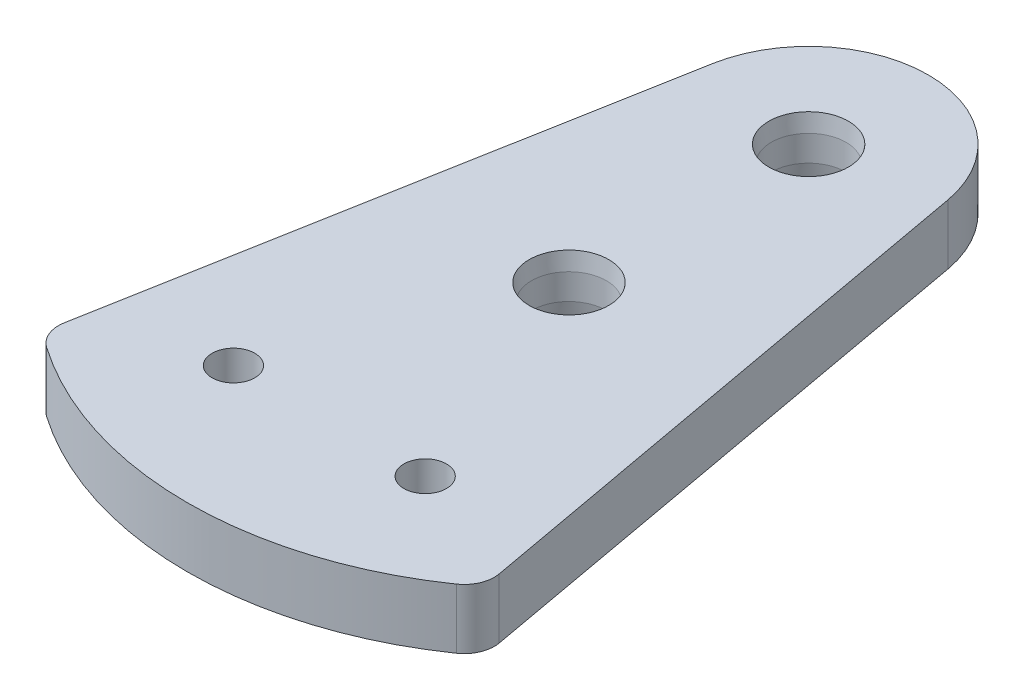
from build123d import *
from OCP.BRepFilletAPI import BRepFilletAPI_MakeChamfer

# Parameters (mm, degrees)
BOSS_EXTRUDE1_DEPTH   = 3.175
F_4_40_TAPPED_HOLE1_D = 2.2606
CUT_EXTRUDE1_REACH    = 37.03
SKETCH3_R             = 1.9812
CHAMFER1_SIZE         = 0.127
CHAMFER1_SIZE2        = 0.903651955


with BuildPart() as part:
    # Sketch2 → Boss-Extrude1 (new body)
    with BuildSketch(Plane(origin=(0, 0, 0), x_dir=(1, 0, 0), z_dir=(0, 1, 0))):
        with BuildLine():
            Line((-6.247852156, 1.134391221), (-11.522869846, -27.918663873))
            ThreePointArc((-11.522869846, -27.918663873), (-11.4270655, -28.816266687), (-10.860710811, -29.519197446))
            ThreePointArc((-10.860710811, -29.519197446), (0, -32.9184), (10.860710811, -29.519197446))
            ThreePointArc((10.860710811, -29.519197446), (11.4270655, -28.816266687), (11.522869846, -27.918663873))
            Line((11.522869846, -27.918663873), (6.247852156, 1.134391221))
            ThreePointArc((6.247852156, 1.134391221), (0, 6.35), (-6.247852156, 1.134391221))
        make_face()
    extrude(amount=BOSS_EXTRUDE1_DEPTH)

    # #4-40 Tapped Hole1 (through all)
    with Locations(Plane(origin=(0, 3.175, 0), x_dir=(1, 0, 0), z_dir=(0, 1, 0))):
        with Locations((-5.08, -25.4), (5.08, -25.4)):
            Hole(F_4_40_TAPPED_HOLE1_D / 2)

    # Sketch3 → Cut-Extrude1 (cut, up to next)
    with BuildSketch(Plane(origin=(0, 3.175, 0), x_dir=(1, 0, 0), z_dir=(0, 1, 0)), mode=Mode.PRIVATE) as cut_extrude1_sk1:
        with Locations(Location((0, 0, 0), (0, 0, 270))):
            Circle(SKETCH3_R)
    cut_extrude1_tool1 = extrude(cut_extrude1_sk1.sketch, amount=-CUT_EXTRUDE1_REACH, mode=Mode.PRIVATE) & part.part
    # Sketch3 → Cut-Extrude1 (cut, up to next)
    with BuildSketch(Plane(origin=(0, 3.175, 0), x_dir=(1, 0, 0), z_dir=(0, 1, 0)), mode=Mode.PRIVATE) as cut_extrude1_sk2:
        with Locations(Location((0, -12.7, 0), (0, 0, 270))):
            Circle(SKETCH3_R)
    cut_extrude1_tool2 = extrude(cut_extrude1_sk2.sketch, amount=-CUT_EXTRUDE1_REACH, mode=Mode.PRIVATE) & part.part
    add(cut_extrude1_tool1.solids().sort_by_distance((0, 3.175, 0))[0], mode=Mode.SUBTRACT)
    add(cut_extrude1_tool2.solids().sort_by_distance((0, 3.175, 12.7))[0], mode=Mode.SUBTRACT)

    # Chamfer1: one chamfer whose edges measure the first distance from different faces: ONE call of the kernel's chamfer builder (chamfer() names one face for all edges)
    chamfer1_edges_1 = [part.edges().sort_by_distance(p)[0] for p in [
        (0, 3.175, -1.9812),
        (0, 3.175, 10.7188),
    ]]
    chamfer1_side_1 = [part.faces().sort_by_distance(p)[0] for p in [
        (0, 3.175, 15.711859533),
    ]]
    chamfer1_edges_2 = [part.edges().sort_by_distance(p)[0] for p in [
        (0, 0, -1.9812),
        (0, 0, 10.7188),
    ]]
    chamfer1_side_2 = [part.faces().sort_by_distance(p)[0] for p in [
        (0, 0, 15.711859533),
    ]]
    chamfer1 = BRepFilletAPI_MakeChamfer(part.part.solid().wrapped)
    for e in chamfer1_edges_1:
        chamfer1.Add(CHAMFER1_SIZE, CHAMFER1_SIZE2, e.wrapped, chamfer1_side_1[0].wrapped)  # the first distance lies on this face
    for e in chamfer1_edges_2:
        chamfer1.Add(CHAMFER1_SIZE, CHAMFER1_SIZE2, e.wrapped, chamfer1_side_2[0].wrapped)  # the first distance lies on this face
    add(Compound.cast(chamfer1.Shape()), mode=Mode.REPLACE)


solid = part.part
